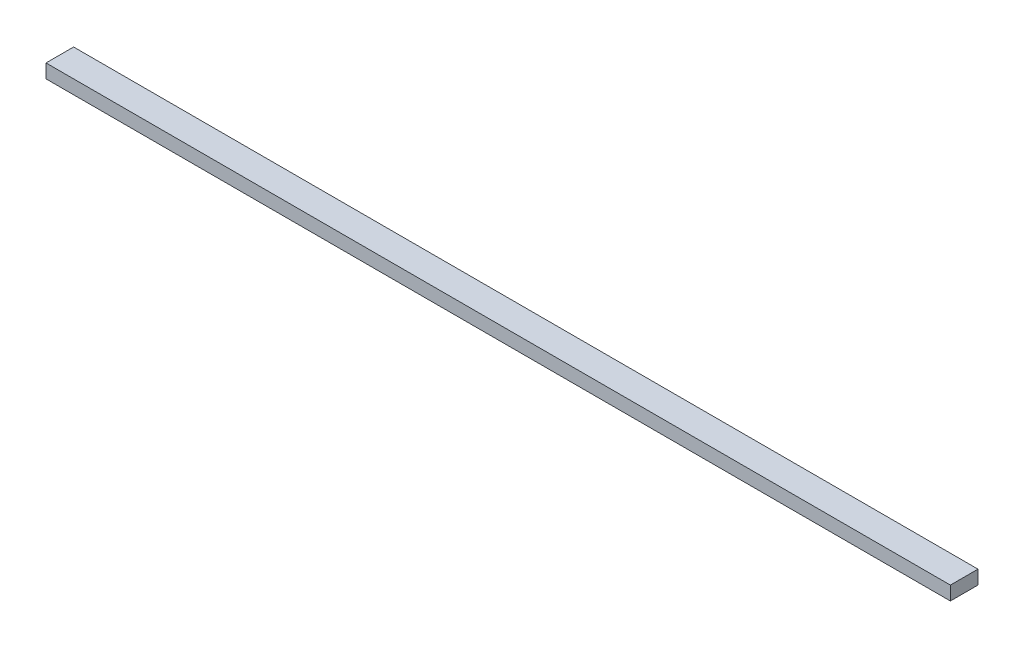
from build123d import *

# Parameters (mm, degrees)
ESQUISSE1_W        = 655
ESQUISSE1_H        = 20
BOSS_EXTRU_1_DEPTH = 10


with BuildPart() as part:
    # Esquisse1 → Boss.-Extru.1 (new body)
    with BuildSketch(Plane(origin=(0, 0, 0), x_dir=(1, 0, 0), z_dir=(0, 1, 0))):
        Rectangle(ESQUISSE1_W, ESQUISSE1_H)
    extrude(amount=BOSS_EXTRU_1_DEPTH)


solid = part.part
